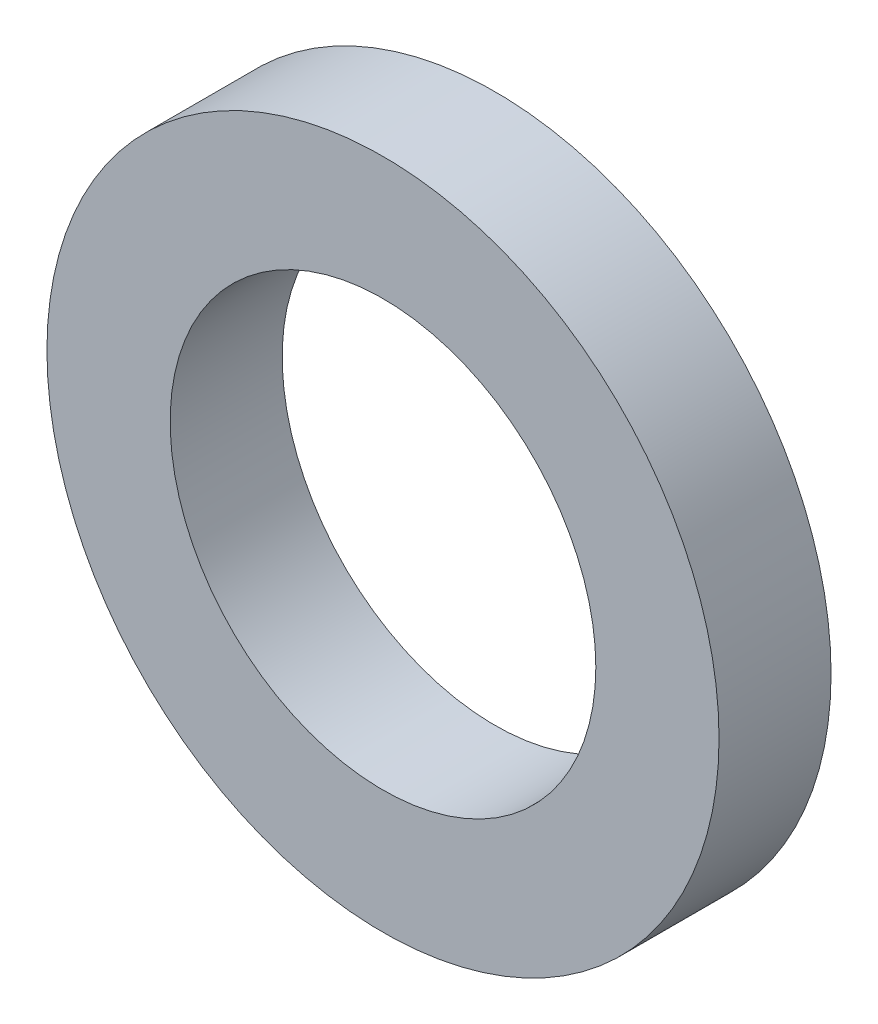
from build123d import *

# Parameters (mm, degrees)
SKETCH1_R           = 3
SKETCH1_R_2         = 1.9
BOSS_EXTRUDE1_DEPTH = 0.5


with BuildPart() as part:
    # Sketch1 → Boss-Extrude1 (new, symmetric)
    with BuildSketch(Plane.XY):
        Circle(SKETCH1_R)
        Circle(SKETCH1_R_2, mode=Mode.SUBTRACT)
    extrude(amount=BOSS_EXTRUDE1_DEPTH, both=True)


solid = part.part
